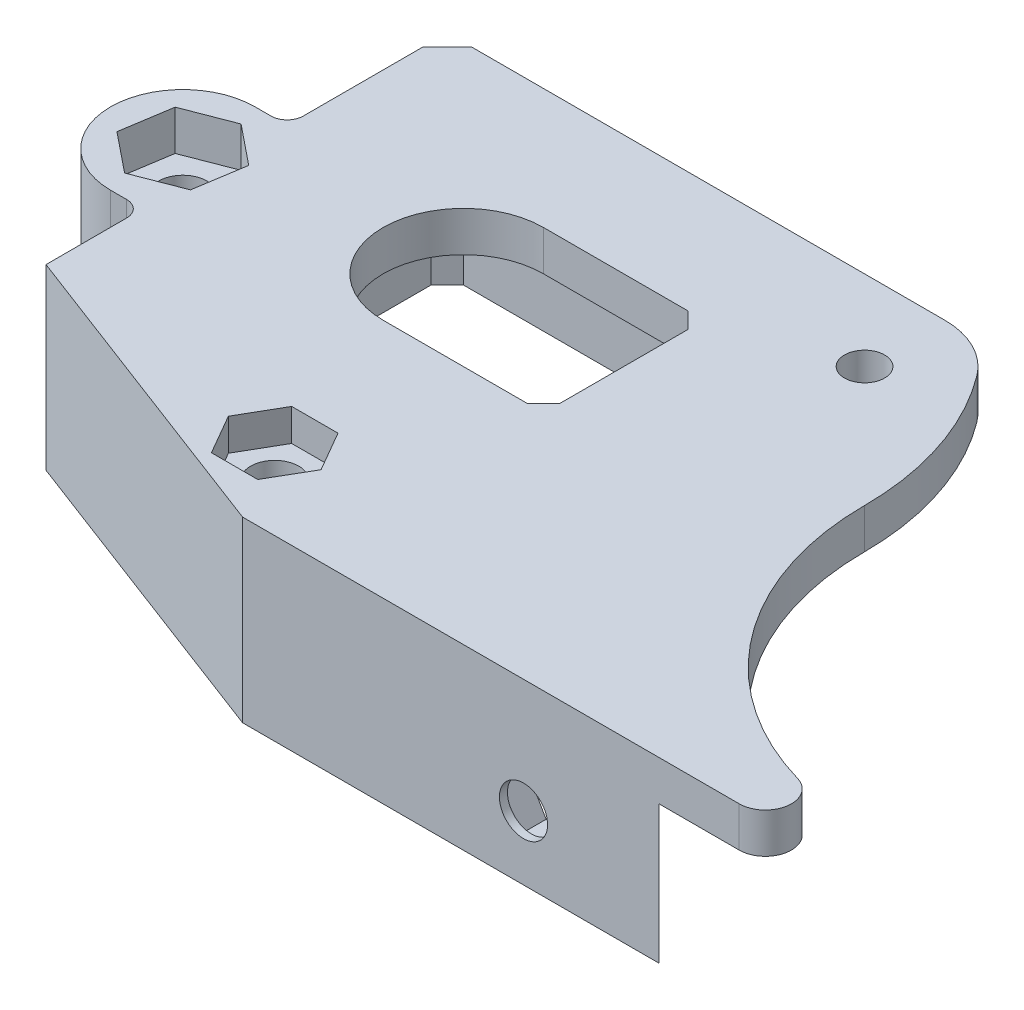
from build123d import *

# Parameters (mm, degrees)
BOSS_EXTRUDE1_DEPTH = 17.2
CHAMFER1_SIZE       = 3
CHAMFER2_SIZE       = 2
SKETCH3_R           = 2.5
SKETCH3_R_2         = 3
BOSS_EXTRUDE2_DEPTH = 5
BOSS_EXTRUDE3_START = 17.2
SKETCH5_R           = 3
BOSS_EXTRUDE3_DEPTH = 17.2
BOSS_EXTRUDE4_DEPTH = 22.2
FILLET1_R           = 2
SKETCH8_R           = 3
CUT_EXTRUDE3_DEPTH  = 31
CUT_EXTRUDE4_DEPTH  = 5
SKETCH10_R          = 3
CUT_EXTRUDE5_DEPTH  = 44
FILLET2_R           = 2
CHAMFER3_SIZE       = 2
CUT_EXTRUDE6_DEPTH  = 4
CUT_EXTRUDE7_DEPTH  = 5


with BuildPart() as part:
    # Sketch2 → Boss-Extrude1 (new body)
    with BuildSketch(Plane(origin=(0, 0, 0), x_dir=(1, 0, 0), z_dir=(0, 1, 0))):
        with BuildLine():
            Line((-112, 25), (-112, -25))
            Line((-112, -25), (-72.5, -40))
            Line((-72.5, -40), (-20.615528128, -40))
            ThreePointArc((-20.615528128, -40), (-25.226188309, -37.264452544), (-29.478805946, -34))
            Line((-29.478805946, -34), (-77.032741633, -34))
            Line((-77.032741633, -34), (-108, -22.240281633))
            Line((-108, -22.240281633), (-108, 21))
            Line((-108, 21), (-60, 21))
            ThreePointArc((-60, 21), (-58.246211251, 23.246211251), (-56, 25))
            Line((-56, 25), (-112, 25))
        make_face()
    extrude(amount=BOSS_EXTRUDE1_DEPTH)

    # Chamfer1
    chamfer1_edges = [part.edges().sort_by_distance(p)[0] for p in [
        (-112, 8.6, -25),
    ]]
    chamfer(chamfer1_edges, length=CHAMFER1_SIZE)

    # Chamfer2
    chamfer2_edges = [part.edges().sort_by_distance(p)[0] for p in [
        (-108, 8.6, -21),
    ]]
    chamfer(chamfer2_edges, length=CHAMFER2_SIZE)

    # Sketch3 → Boss-Extrude2 (add)
    with BuildSketch(Plane(origin=(0, 17.2, 0), x_dir=(1, 0, 0), z_dir=(0, 1, 0))):
        with BuildLine():
            Line((-72.5, -40), (-20.615528128, -40))
            Line((-20.615528128, -40), (-10.615528128, -40))
            ThreePointArc((-10.615528128, -40), (-7.396351284, -37.204380582), (-9.713234444, -33.625185154))
            ThreePointArc((-9.713234444, -33.625185154), (-27.972872623, -21.03612125), (-35, 0))
            ThreePointArc((-35, 0), (-36.796084568, 11.067971811), (-42, 21))
            ThreePointArc((-42, 21), (-45.527864045, 23.94427191), (-50, 25))
            Line((-50, 25), (-109, 25))
            Line((-109, 25), (-112, 22))
            Line((-112, 22), (-112, -25))
            Line((-112, -25), (-72.5, -40))
        make_face()
        with Locations(Location((-50, 15, 0), (0, 0, 270))):
            Circle(SKETCH3_R, mode=Mode.SUBTRACT)
        with Locations(Location((-78.5, -30, 0), (0, 0, 270))):
            Circle(SKETCH3_R_2, mode=Mode.SUBTRACT)
        with BuildLine():
            Line((-85, 10), (-65, 10))
            Line((-65, 10), (-65, -10))
            Line((-65, -10), (-85, -10))
            ThreePointArc((-85, -10), (-95, 0), (-85, 10))
        make_face(mode=Mode.SUBTRACT)
    extrude(amount=BOSS_EXTRUDE2_DEPTH)

    # Sketch5 → Boss-Extrude3 (add)
    with BuildSketch(Plane.XZ.offset(-17.2).offset(BOSS_EXTRUDE3_START)):
        with BuildLine():
            Line((-73.5, 30), (-73.5, 34))
            Line((-73.5, 34), (-83.5, 34))
            Line((-83.5, 34), (-83.5, 30))
            ThreePointArc((-83.5, 30), (-78.5, 25), (-73.5, 30))
        make_face()
        with Locations(Location((-78.5, 30, 0), (0, 0, 270))):
            Circle(SKETCH5_R, mode=Mode.SUBTRACT)
    extrude(amount=-BOSS_EXTRUDE3_DEPTH)

    # Sketch7 → Boss-Extrude4 (add)
    with BuildSketch(Plane(origin=(0, 22.2, 0), x_dir=(1, 0, 0), z_dir=(0, 1, 0))):
        with BuildLine():
            Line((-112, 5.05), (-112, -12.95))
            Line((-112, -12.95), (-116, -12.95))
            ThreePointArc((-116, -12.95), (-125, -3.95), (-116, 5.05))
            Line((-116, 5.05), (-112, 5.05))
        make_face()
    extrude(amount=-BOSS_EXTRUDE4_DEPTH)

    # Fillet1
    fillet1_edges = [part.edges().sort_by_distance(p)[0] for p in [
        (-112, 11.1, 12.95),
        (-112, 11.1, -5.05),
    ]]
    fillet(fillet1_edges, radius=FILLET1_R)

    # Sketch8 → Cut-Extrude3 (cut)
    with BuildSketch(Plane(origin=(0, 22.2, 0), x_dir=(1, 0, 0), z_dir=(0, 1, 0))):
        with Locations(Location((-116, -3.95, 0), (0, 0, 270))):
            Circle(SKETCH8_R)
    extrude(amount=-CUT_EXTRUDE3_DEPTH, mode=Mode.SUBTRACT)

    # Sketch9 → Cut-Extrude4 (cut)
    with BuildSketch(Plane(origin=(0, 22.2, 0), x_dir=(1, 0, 0), z_dir=(0, 1, 0))):
        Polygon((-110.074764358, -1.664192501), (-115.016949541, 2.324308339), (-120.942185183, 0.03850084), (-121.925235642, -6.235807499), (-116.983050459, -10.224308339), (-111.057814817, -7.93850084), align=None)
    extrude(amount=-CUT_EXTRUDE4_DEPTH, mode=Mode.SUBTRACT)

    # Sketch10 → Cut-Extrude5 (cut)
    with BuildSketch(Plane.XY.offset(40)):
        with Locations((-37.5, 8)):
            Circle(SKETCH10_R)
    extrude(amount=-CUT_EXTRUDE5_DEPTH, mode=Mode.SUBTRACT)

    # Fillet2
    fillet2_edges = [part.edges().sort_by_distance(p)[0] for p in [
        (-83.5, 8.6, 31.544079101),
        (-73.5, 8.6, 34),
    ]]
    fillet(fillet2_edges, radius=FILLET2_R)

    # Chamfer3
    chamfer3_edges = [part.edges().sort_by_distance(p)[0] for p in [
        (-65, 19.7, 10),
        (-65, 19.7, -10),
    ]]
    chamfer(chamfer3_edges, length=CHAMFER3_SIZE)

    # Sketch11 → Cut-Extrude6 (cut)
    with BuildSketch(Plane(origin=(0, 22.2, 0), x_dir=(1, 0, 0), z_dir=(0, 1, 0))):
        Polygon((-72.726497308, -30), (-75.613248654, -25), (-81.386751346, -25), (-84.273502692, -30), (-81.386751346, -35), (-75.613248654, -35), align=None)
    extrude(amount=-CUT_EXTRUDE6_DEPTH, mode=Mode.SUBTRACT)

    # Sketch12 → Cut-Extrude7 (cut)
    with BuildSketch(Plane(origin=(0, 0, 34), x_dir=(-1, 0, 0), z_dir=(0, 0, -1))):
        Polygon((43.850852961, 8), (40.675426481, 13.5), (34.324573519, 13.5), (31.149147039, 8), (34.324573519, 2.5), (40.675426481, 2.5), align=None)
    extrude(amount=-CUT_EXTRUDE7_DEPTH, mode=Mode.SUBTRACT)


solid = part.part
